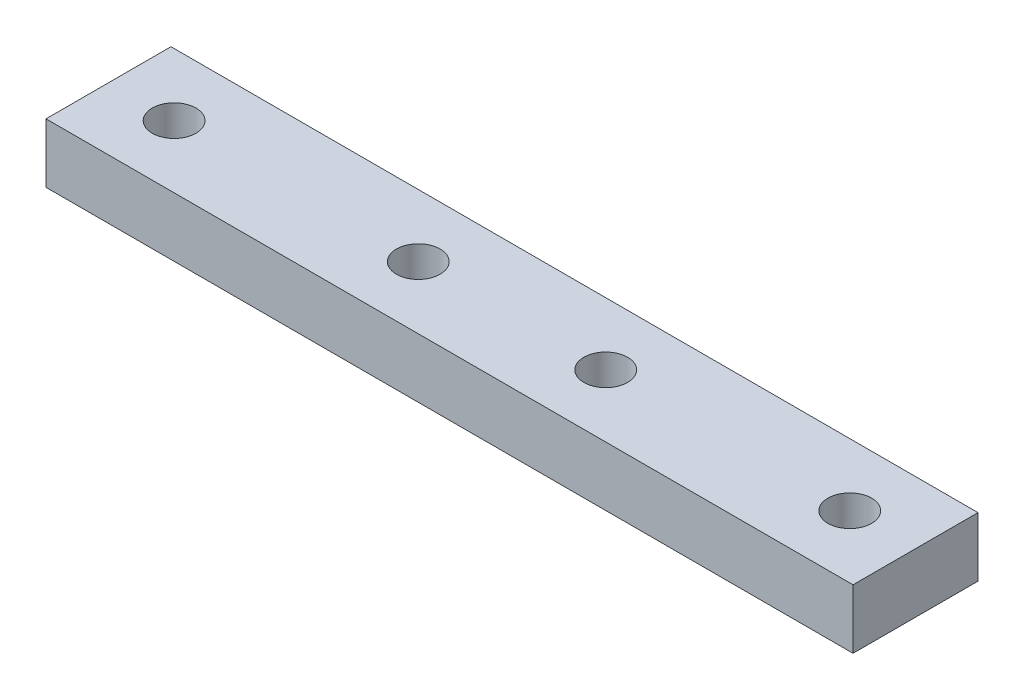
from build123d import *

# Parameters (mm, degrees)
SKETCH_V_W          = 64.58
SKETCH_V_H          = 10
BOSS_EXTRUDE1_DEPTH = 4.75
SKETCH2_R           = 1.75
CUT_EXTRUDE1_DEPTH  = 34.018276757


with BuildPart() as part:
    # Sketch v → Boss-Extrude1 (new body)
    with BuildSketch(Plane(origin=(0, 0, 0), x_dir=(1, 0, 0), z_dir=(0, 1, 0))):
        Rectangle(SKETCH_V_W, SKETCH_V_H)
    extrude(amount=BOSS_EXTRUDE1_DEPTH)

    # Sketch2 → Cut-Extrude1 (cut, through all)
    with BuildSketch(Plane(origin=(0, 4.75, 0), x_dir=(1, 0, 0), z_dir=(0, 1, 0))):
        with Locations(Location((-27.0395, 0, 0), (0, 0, 270))):
            Circle(SKETCH2_R)
        with Locations(Location((27.0305, 0, 0), (0, 0, 270))):
            Circle(SKETCH2_R)
        with Locations(Location((7.5, 0, 0), (0, 0, 270))):
            Circle(SKETCH2_R)
        with Locations(Location((-7.5, 0, 0), (0, 0, 270))):
            Circle(SKETCH2_R)
    extrude(amount=-CUT_EXTRUDE1_DEPTH, mode=Mode.SUBTRACT)


solid = part.part
